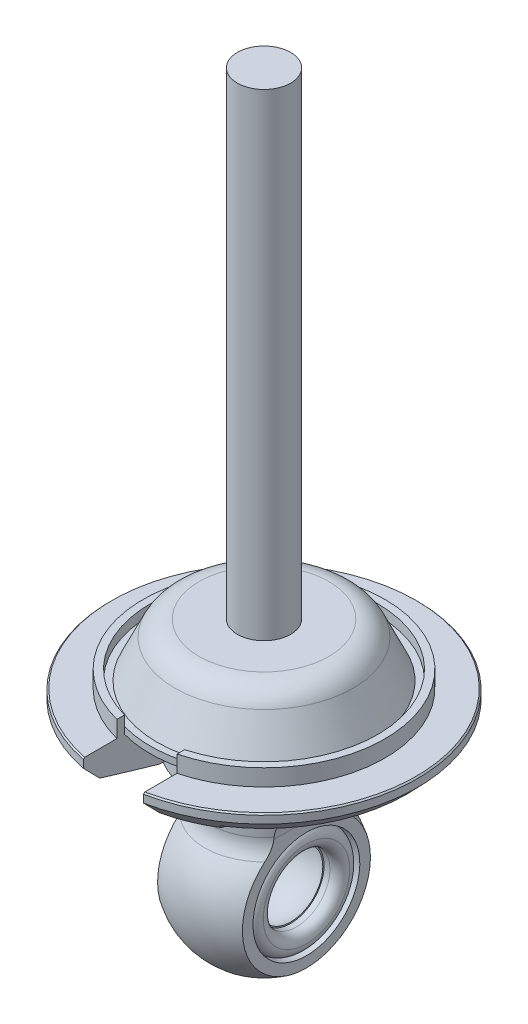
from build123d import *

# Parameters (mm, degrees)
CUT_EXTRUDE6_DEPTH      = 214.620871874
CUT_EXTRUDE6_DEPTH_BACK = 214.620871874
CUT_EXTRUDE7_REACH      = 94.882
CUT_EXTRUDE8_DEPTH      = 2.5
SKETCH5_R               = 8
CUT_EXTRUDE9_DEPTH      = 215.397526596
SKETCH6_R               = 8
BOSS_EXTRUDE1_DEPTH     = 4
SKETCH7_R               = 7.95
SKETCH7_R_2             = 4.99
BOSS_EXTRUDE2_DEPTH     = 2.35
FILLET1_R               = 1.47
FILLET1_OF_MIRROR1_R    = 1.47


with BuildPart() as part:
    # Sketch1 → Revolve1 (revolve)
    with BuildSketch(Plane(origin=(0, 0, 0), x_dir=(0, 0, -1), z_dir=(1, 0, 0)), mode=Mode.PRIVATE) as revolve1_sk:
        with BuildLine():
            Line((0, -95.63), (3.99, -95.63))
            Line((3.99, -95.63), (3.99, -167.13))
            Line((3.99, -167.13), (9.721257692, -167.13))
            ThreePointArc((9.721257692, -167.13), (11.870456125, -167.756434217), (13.34648884, -169.439526953))
            Line((13.34648884, -169.439526953), (16, -175.13))
            Line((16, -175.13), (17, -175.13))
            Line((17, -175.13), (17, -173.63))
            Line((17, -173.63), (18.1, -173.63))
            Line((18.1, -173.63), (18.1, -176.13))
            Line((18.1, -176.13), (22.8, -176.13))
            Line((22.8, -176.13), (23, -176.33))
            Line((23, -176.33), (23, -177.48))
            Line((23, -177.48), (20.61, -179.97))
            Line((20.61, -179.97), (12, -182.63))
            Line((12, -182.63), (10.95, -182.63))
            Line((10.95, -182.63), (10.95, -184))
            Line((10.95, -184), (10.694559122, -184.23))
            ThreePointArc((10.694559122, -184.23), (8.77330709, -185.203978011), (8, -187.214410473))
            Line((8, -187.214410473), (8, -189.819291565))
            ThreePointArc((8, -189.819291565), (8.232567401, -191.163334575), (8.903225806, -192.35108729))
            ThreePointArc((8.903225806, -192.35108729), (10.391282312, -204.556586234), (0, -211.13))
            Line((0, -211.13), (0, -95.63))
        make_face()
    revolve(revolve1_sk.sketch.rotate(Axis((0, 0, 0), (0, -1, 0)), 180), axis=Axis((0, 0, 0), (0, -1, 0)))

    # Sketch2 → Cut-Extrude6 (cut, two sides: drawn at the far end of the back side and taken through both)
    with BuildSketch(Plane.XY.offset(-CUT_EXTRUDE6_DEPTH_BACK)):
        with BuildLine():
            Line((6.35, -209.217882978), (6.35, -190.13))
            ThreePointArc((6.35, -190.13), (7.153847577, -187.13), (9.35, -184.933847577))
            Line((9.35, -184.933847577), (9.35, -182.63))
            Line((9.35, -182.63), (11, -182.63))
            Line((11, -182.63), (11, -180.03))
            ThreePointArc((11, -180.03), (11.234314575, -179.464314575), (11.8, -179.23))
            Line((11.8, -179.23), (22.5, -179.23))
            Line((22.5, -179.23), (22.5, -214.63))
            Line((22.5, -214.63), (6.35, -214.63))
            Line((6.35, -214.63), (6.35, -209.217882978))
        make_face()
        with BuildLine():
            Line((-6.35, -214.63), (-6.35, -209.217882978))
            Line((-6.35, -209.217882978), (-6.35, -190.13))
            ThreePointArc((-6.35, -190.13), (-7.153847577, -187.13), (-9.35, -184.933847577))
            Line((-9.35, -184.933847577), (-9.35, -182.63))
            Line((-9.35, -182.63), (-11, -182.63))
            Line((-11, -182.63), (-11, -180.03))
            ThreePointArc((-11, -180.03), (-11.234314575, -179.464314575), (-11.8, -179.23))
            Line((-11.8, -179.23), (-22.5, -179.23))
            Line((-22.5, -179.23), (-22.5, -214.63))
            Line((-22.5, -214.63), (-6.35, -214.63))
        make_face()
    extrude(amount=CUT_EXTRUDE6_DEPTH + CUT_EXTRUDE6_DEPTH_BACK, mode=Mode.SUBTRACT)

    # Cut-Extrude7: up to this face of the body (flat: up to its plane)
    cut_extrude7_end = Plane(part.part.faces().sort_by_distance((0, -176.13, -18.744881384))[0])
    # Sketch3 → Cut-Extrude7 (cut, up to the picked face)
    with BuildSketch(Plane.XZ.offset(182.63), mode=Mode.PRIVATE) as cut_extrude7_sk1:
        with BuildLine():
            Line((4.5, 9.982609879), (4.5, 28.284063509))
            Line((4.5, 28.284063509), (-4.5, 28.284063509))
            Line((-4.5, 28.284063509), (-4.5, 9.982609879))
            ThreePointArc((-4.5, 9.982609879), (0, 10.95), (4.5, 9.982609879))
        make_face()
    cut_extrude7_tool1 = split(extrude(cut_extrude7_sk1.sketch, amount=-CUT_EXTRUDE7_REACH, mode=Mode.PRIVATE), bisect_by=cut_extrude7_end, keep=Keep.BOTH, mode=Mode.PRIVATE)
    add(cut_extrude7_tool1.solids().sort_by(Axis((0, -182.63, 19.456437), (0, 1, 0)))[0], mode=Mode.SUBTRACT)

    # Sketch4 → Cut-Extrude8 (cut)
    with BuildSketch(Plane(origin=(0, -176.13, 0), x_dir=(1, 0, 0), z_dir=(0, 1, 0))):
        with BuildLine():
            Line((-4.5, -16.393596311), (-4.5, -17.531685601))
            ThreePointArc((-4.5, -17.531685601), (0, -18.1), (4.5, -17.531685601))
            Line((4.5, -17.531685601), (4.5, -16.393596311))
            ThreePointArc((4.5, -16.393596311), (0, -17), (-4.5, -16.393596311))
        make_face()
    extrude(amount=CUT_EXTRUDE8_DEPTH, mode=Mode.SUBTRACT)

    # Sketch5 → Cut-Extrude9 (cut, through all)
    with BuildSketch(Plane(origin=(6.35, 0, 0), x_dir=(0, 0, -1), z_dir=(1, 0, 0))):
        with Locations(Location((0, -199.63, 0), (0, 0, 90))):
            Circle(SKETCH5_R)
    extrude(amount=-CUT_EXTRUDE9_DEPTH, mode=Mode.SUBTRACT)

    # Sketch6 → Boss-Extrude1 (add, symmetric)
    with BuildSketch(Plane(origin=(0, 0, 0), x_dir=(0, 0, -1), z_dir=(1, 0, 0))):
        with Locations(Location((0, -199.63, 0), (0, 0, 90))):
            Circle(SKETCH6_R)
    extrude(amount=BOSS_EXTRUDE1_DEPTH, both=True)

    # Sketch7 → Boss-Extrude2 (add)
    with BuildSketch(Plane(origin=(4, 0, 0), x_dir=(0, 0, -1), z_dir=(1, 0, 0))):
        with Locations((0, -199.63)):
            Circle(SKETCH7_R)
        with Locations((0, -199.63)):
            Circle(SKETCH7_R_2, mode=Mode.SUBTRACT)
    boss_extrude2 = extrude(amount=BOSS_EXTRUDE2_DEPTH)

    # Fillet1
    fillet1_edges = [part.edges().sort_by_distance(p)[0] for p in [
        (6.35, -199.63, 7.95),
        (6.35, -199.63, 4.99),
    ]]
    fillet(fillet1_edges, radius=FILLET1_R)

    # Mirror1: Boss-Extrude2 across plane
    add(boss_extrude2.mirror(Plane(origin=(0, 0, 0), x_dir=(0, 0, 1), z_dir=(1, 0, 0))))

    # Fillet1 of Mirror1
    fillet1_of_mirror1_edges = [part.edges().sort_by_distance(p)[0] for p in [
        (-6.35, -199.63, 7.95),
        (-6.35, -199.63, 4.99),
    ]]
    fillet(fillet1_of_mirror1_edges, radius=FILLET1_OF_MIRROR1_R)

    # Sketch8 → Cut-Revolve1 (revolve, cut)
    with BuildSketch(Plane(origin=(0, 0, 0), x_dir=(0, 0, -1), z_dir=(1, 0, 0))):
        with BuildLine():
            Line((0, -193.38), (0, -205.88))
            ThreePointArc((0, -205.88), (6.25, -199.63), (0, -193.38))
        make_face()
    revolve(axis=Axis((0, -211.13, 0), (0, 1, 0)), mode=Mode.SUBTRACT)


solid = part.part
